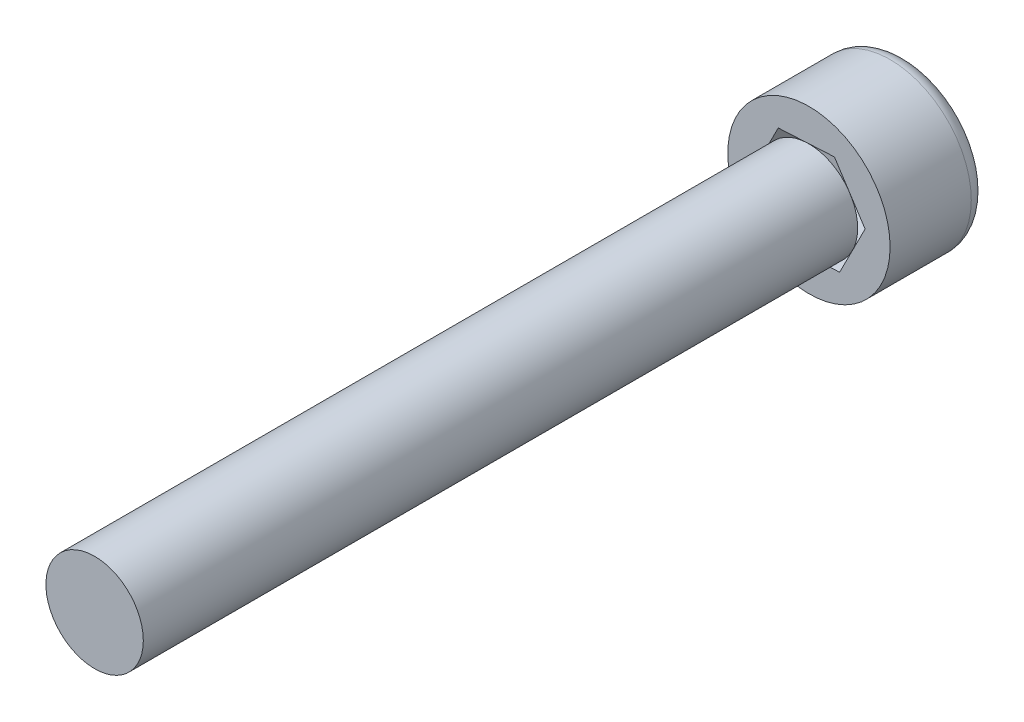
from build123d import *

# Parameters (mm, degrees)
SKETCH1_R           = 2.5
BOSS_EXTRUDE1_DEPTH = 3
SKETCH2_R           = 1.5
BOSS_EXTRUDE2_DEPTH = 22
CUT_EXTRUDE1_DEPTH  = 3
FILLET1_R           = 0.5


with BuildPart() as part:
    # Sketch1 → Boss-Extrude1 (new body)
    with BuildSketch(Plane.XY):
        Circle(SKETCH1_R)
    extrude(amount=BOSS_EXTRUDE1_DEPTH)

    # Sketch2 → Boss-Extrude2 (add)
    with BuildSketch(Plane.XY.offset(3)):
        Circle(SKETCH2_R)
    extrude(amount=BOSS_EXTRUDE2_DEPTH)

    # Sketch3 → Cut-Extrude1 (cut)
    with BuildSketch(Plane(origin=(0, 0, 0), x_dir=(-1, 0, 0), z_dir=(0, 0, -1))):
        Polygon((0.784462107, -1.544221229), (1.729565866, -0.092746502), (0.94510376, 1.451474727), (-0.784462107, 1.544221229), (-1.729565866, 0.092746502), (-0.94510376, -1.451474727), align=None)
    extrude(amount=-CUT_EXTRUDE1_DEPTH, mode=Mode.SUBTRACT)


with BuildPart() as cut_extrude1_piece_1:
    # of the separate pieces the step leaves, piece 1, a body of its own (cut_extrude1_pieces)
    add(part.part.solids().sort_by_distance((1.5, 0, 3))[0])


with BuildPart() as cut_extrude1_piece_2:
    # of the separate pieces the step leaves, piece 2, a body of its own (cut_extrude1_pieces)
    add(part.part.solids().sort_by_distance((2.5, 0, 0))[0])

    # Fillet1
    fillet1_edges = [cut_extrude1_piece_2.edges().sort_by_distance(p)[0] for p in [
        (-2.5, 0, 0),
    ]]
    fillet(fillet1_edges, radius=FILLET1_R)


solid = Compound([cut_extrude1_piece_1.part, cut_extrude1_piece_2.part])
